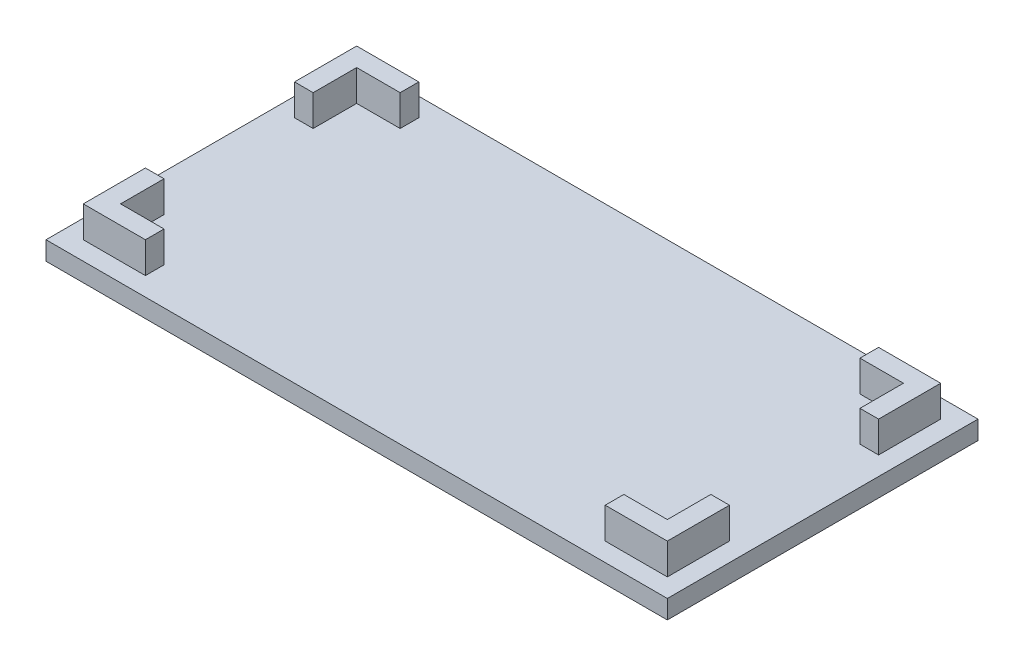
from build123d import *

# Parameters (mm, degrees)
SKETCH2_W           = 100
SKETCH2_H           = 50
BOSS_EXTRUDE1_DEPTH = 3
BOSS_EXTRUDE2_DEPTH = 5


with BuildPart() as part:
    # Sketch2 → Boss-Extrude1 (new body)
    with BuildSketch(Plane(origin=(0, 0, 0), x_dir=(1, 0, 0), z_dir=(0, 1, 0))):
        with Locations((50, 25)):
            Rectangle(SKETCH2_W, SKETCH2_H)
    extrude(amount=BOSS_EXTRUDE1_DEPTH)

    # Sketch3 → Boss-Extrude2 (add)
    with BuildSketch(Plane(origin=(0, 3, 0), x_dir=(1, 0, 0), z_dir=(0, 1, 0))):
        Polygon((3, 37), (3, 47), (13, 47), (13, 44), (6, 44), (6, 37), align=None)
        Polygon((13, 3), (3, 3), (3, 13), (6, 13), (6, 6), (13, 6), align=None)
        Polygon((97, 13), (97, 3), (87, 3), (87, 6), (94, 6), (94, 13), align=None)
        Polygon((87, 47), (97, 47), (97, 37), (94, 37), (94, 44), (87, 44), align=None)
    extrude(amount=BOSS_EXTRUDE2_DEPTH)


solid = part.part
